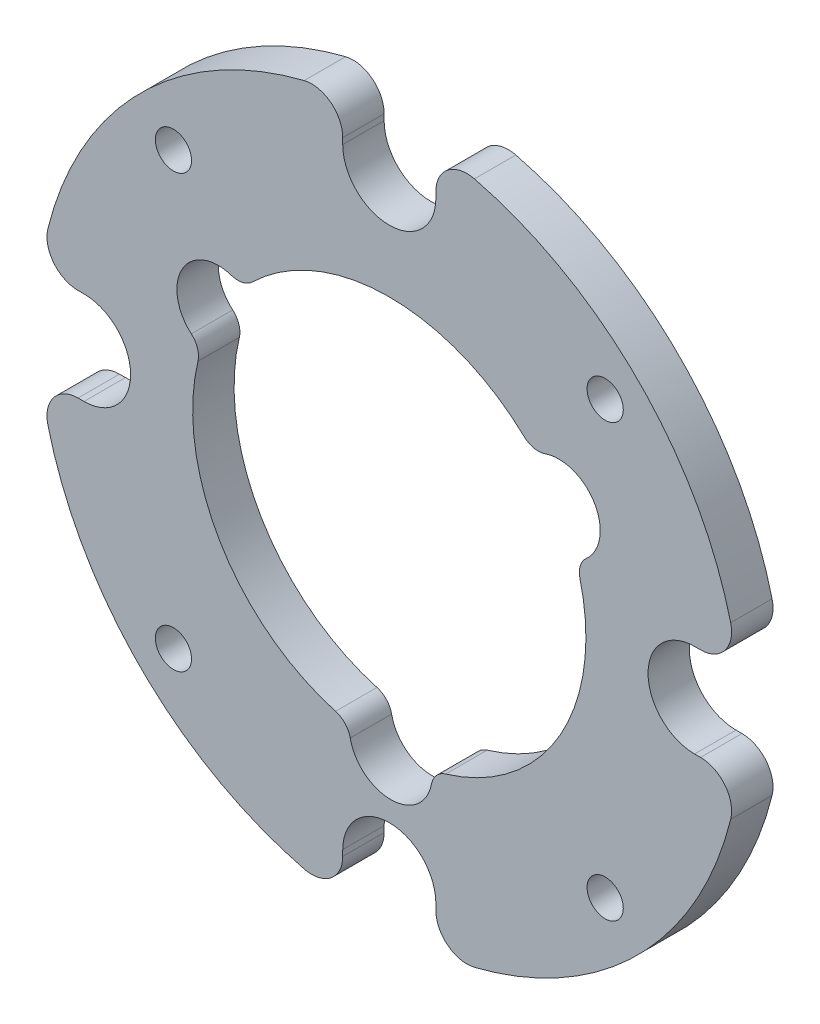
from build123d import *

# Parameters (mm, degrees)
SKETCH5_R                = 34
SKETCH5_R_2              = 19
BOSS_EXTRUDE1_DEPTH      = 4
SKETCH8_R                = 1.75
CUT_EXTRUDE3_DEPTH       = 5
SKETCH27_R               = 1.75
CUT_EXTRUDE9_DEPTH       = 5
SKETCH28_R               = 4.5
SKETCH28_R_2             = 1.75
CUT_EXTRUDE10_DEPTH      = 10
FILLET1_R                = 3
CIRPATTERN1_COUNT        = 4
FILLET1_OF_CIRPATTERN1_R = 3
SKETCH32_R               = 4
CUT_EXTRUDE11_DEPTH      = 10
FILLET2_R                = 2


with BuildPart() as part:
    # Sketch5 → Boss-Extrude1 (new body)
    with BuildSketch(Plane.XY):
        Circle(SKETCH5_R)
        Circle(SKETCH5_R_2, mode=Mode.SUBTRACT)
    extrude(amount=-BOSS_EXTRUDE1_DEPTH)

    # Sketch8 → Cut-Extrude3 (cut)
    with BuildSketch(Plane.XY):
        with Locations((20.859650045, 20.859650045)):
            Circle(SKETCH8_R)
        with Locations((-20.859650045, 20.859650045)):
            Circle(SKETCH8_R)
        with Locations((-20.859650045, -20.859650045)):
            Circle(SKETCH8_R)
        with Locations((20.859650045, -20.859650045)):
            Circle(SKETCH8_R)
    extrude(amount=-CUT_EXTRUDE3_DEPTH, mode=Mode.SUBTRACT)

    # Sketch27 → Cut-Extrude9 (cut)
    with BuildSketch(Plane.XY):
        with Locations((0, 29.5)):
            Circle(SKETCH27_R)
        with Locations((29.5, 0)):
            Circle(SKETCH27_R)
        with Locations((0, -29.5)):
            Circle(SKETCH27_R)
        with Locations((-29.5, 0)):
            Circle(SKETCH27_R)
    extrude(amount=-CUT_EXTRUDE9_DEPTH, mode=Mode.SUBTRACT)

    # Sketch28 → Cut-Extrude10 (cut)
    # profile 1 of 4: a face of its own
    with BuildSketch(Plane.XY):
        with BuildLine():
            Line((-4.5, 40.049875312), (-4.5, 33.700890196))
            ThreePointArc((-4.5, 33.700890196), (-2.254964893, 33.925140137), (0, 34))
            ThreePointArc((0, 34), (2.254964893, 33.925140137), (4.5, 33.700890196))
            Line((4.5, 33.700890196), (4.5, 40.049875312))
            Line((4.5, 40.049875312), (-4.5, 40.049875312))
        make_face()
    # profile 2 of 4: a face of its own
    with BuildSketch(Plane.XY):
        with BuildLine():
            Line((-4.5, 33.700890196), (-4.5, 29.5))
            ThreePointArc((-4.5, 29.5), (-3.181980515, 32.681980515), (0, 34))
            ThreePointArc((0, 34), (-2.254964893, 33.925140137), (-4.5, 33.700890196))
        make_face()
    # profile 3 of 4: a face of its own
    with BuildSketch(Plane.XY):
        with BuildLine():
            ThreePointArc((0, 34), (3.181980515, 32.681980515), (4.5, 29.5))
            Line((4.5, 29.5), (4.5, 33.700890196))
            ThreePointArc((4.5, 33.700890196), (2.254964893, 33.925140137), (0, 34))
        make_face()
    # profile 4 of 4: a face of its own
    with BuildSketch(Plane.XY):
        with Locations((0, 29.5)):
            Circle(SKETCH28_R)
        with Locations((0, 29.5)):
            Circle(SKETCH28_R_2, mode=Mode.SUBTRACT)
    cut_extrude10 = extrude(amount=-CUT_EXTRUDE10_DEPTH, mode=Mode.SUBTRACT)

    # Fillet1
    fillet1_edges = [part.edges().sort_by_distance(p)[0] for p in [
        (-4.5, 33.700890196, -2),
        (4.5, 33.700890196, -2),
    ]]
    fillet(fillet1_edges, radius=FILLET1_R)

    # CirPattern1: Cut-Extrude10 ×4 about axis
    cirpattern1_axis = Axis((0, 0, 0), (0, 0, 1))
    for i in range(1, CIRPATTERN1_COUNT):
        add(cut_extrude10.rotate(cirpattern1_axis, i * 360 / CIRPATTERN1_COUNT), mode=Mode.SUBTRACT)

    # Fillet1 of CirPattern1
    fillet1_of_cirpattern1_edges = [part.edges().sort_by_distance(p)[0] for p in [
        (-33.700890196, -4.5, -2),
        (-33.700890196, 4.5, -2),
        (4.5, -33.700890196, -2),
        (-4.5, -33.700890196, -2),
        (33.700890196, 4.5, -2),
        (33.700890196, -4.5, -2),
    ]]
    fillet(fillet1_of_cirpattern1_edges, radius=FILLET1_OF_CIRPATTERN1_R)

    # Sketch32 → Cut-Extrude11 (cut)
    with BuildSketch(Plane.XY):
        with Locations((-16.524893724, 9.376987118)):
            Circle(SKETCH32_R)
        with Locations((16.383155917, 9.622484201)):
            Circle(SKETCH32_R)
        with Locations((0.141737807, -18.999471319)):
            Circle(SKETCH32_R)
    extrude(amount=-CUT_EXTRUDE11_DEPTH, mode=Mode.SUBTRACT)

    # Fillet2
    fillet2_edges = [part.edges().sort_by_distance(p)[0] for p in [
        (-3.83907012, -18.608104165, -2),
        (4.116263726, -18.548756641, -2),
        (18.034625983, 5.979319831, -2),
        (14.005562597, 12.839167276, -2),
        (-14.195555863, 12.628784333, -2),
        (-18.121826323, 5.709589366, -2),
    ]]
    fillet(fillet2_edges, radius=FILLET2_R)


solid = part.part
